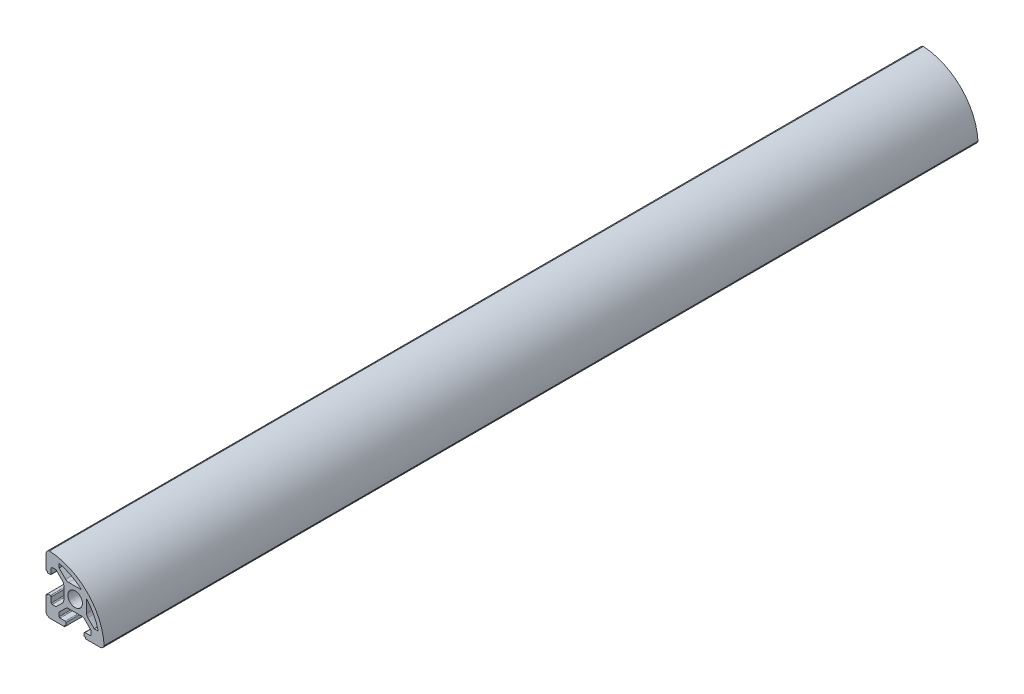
from build123d import *

# Parameters (mm, degrees)
SKETCH_1_R      = 2.5
EXTRUDE_1_DEPTH = 300


with BuildPart() as part:
    # 草图1 → 凸台-拉伸1 (new body)
    with BuildSketch(Plane.XY):
        with BuildLine():
            ThreePointArc((-8.944458369, 9.930115847), (-9.792033903, 9.405190523), (-10.123344197, 8.464890373))
            Line((-10.123344197, 8.464890373), (-10.123344197, 3.564890373))
            Line((-10.123344197, 3.564890373), (-9.823344197, 3.564890373))
            ThreePointArc((-9.823344197, 3.564890373), (-9.681922841, 3.50631173), (-9.623344197, 3.364890373))
            Line((-9.623344197, 3.364890373), (-9.623344197, 3.064890373))
            Line((-9.623344197, 3.064890373), (-8.623344197, 3.064890373))
            ThreePointArc((-8.623344197, 3.064890373), (-8.411212162, 3.152758339), (-8.323344197, 3.364890373))
            Line((-8.323344197, 3.364890373), (-8.323344197, 5.164890373))
            ThreePointArc((-8.323344197, 5.164890373), (-8.235476231, 5.377022408), (-8.023344197, 5.464890373))
            Line((-8.023344197, 5.464890373), (-6.683344197, 5.464890373))
            Line((-6.683344197, 5.464890373), (-4.462684025, 3.244230202))
            ThreePointArc((-4.462684025, 3.244230202), (-4.137524898, 2.757595178), (-4.023344197, 2.18357003))
            Line((-4.023344197, 2.18357003), (-4.023344197, -2.253789283))
            ThreePointArc((-4.023344197, -2.253789283), (-4.137524898, -2.827814432), (-4.462684025, -3.314449455))
            Line((-4.462684025, -3.314449455), (-6.683344197, -5.535109627))
            Line((-6.683344197, -5.535109627), (-8.023344197, -5.535109627))
            ThreePointArc((-8.023344197, -5.535109627), (-8.235476231, -5.447241661), (-8.323344197, -5.235109627))
            Line((-8.323344197, -5.235109627), (-8.323344197, -3.435109627))
            ThreePointArc((-8.323344197, -3.435109627), (-8.411212162, -3.222977592), (-8.623344197, -3.135109627))
            Line((-8.623344197, -3.135109627), (-9.623344197, -3.135109627))
            Line((-9.623344197, -3.135109627), (-9.623344197, -3.435109627))
            ThreePointArc((-9.623344197, -3.435109627), (-9.681922841, -3.576530983), (-9.823344197, -3.635109627))
            Line((-9.823344197, -3.635109627), (-10.123344197, -3.635109627))
            Line((-10.123344197, -3.635109627), (-10.123344197, -8.535109627))
            ThreePointArc((-10.123344197, -8.535109627), (-9.684004369, -9.595769798), (-8.623344197, -10.035109627))
            Line((-8.623344197, -10.035109627), (-3.723344197, -10.035109627))
            Line((-3.723344197, -10.035109627), (-3.723344197, -9.735109627))
            ThreePointArc((-3.723344197, -9.735109627), (-3.664765553, -9.59368827), (-3.523344197, -9.535109627))
            Line((-3.523344197, -9.535109627), (-3.223344197, -9.535109627))
            Line((-3.223344197, -9.535109627), (-3.223344197, -8.535109627))
            ThreePointArc((-3.223344197, -8.535109627), (-3.311212162, -8.322977592), (-3.523344197, -8.235109627))
            Line((-3.523344197, -8.235109627), (-5.323344197, -8.235109627))
            ThreePointArc((-5.323344197, -8.235109627), (-5.535476231, -8.147241661), (-5.623344197, -7.935109627))
            Line((-5.623344197, -7.935109627), (-5.623344197, -6.595109627))
            Line((-5.623344197, -6.595109627), (-3.402684025, -4.374449455))
            ThreePointArc((-3.402684025, -4.374449455), (-2.916049002, -4.049290328), (-2.342023853, -3.935109627))
            Line((-2.342023853, -3.935109627), (2.09533546, -3.935109627))
            ThreePointArc((2.09533546, -3.935109627), (2.669360608, -4.049290328), (3.155995631, -4.374449455))
            Line((3.155995631, -4.374449455), (5.376655803, -6.595109627))
            Line((5.376655803, -6.595109627), (5.376655803, -7.935109627))
            ThreePointArc((5.376655803, -7.935109627), (5.288787838, -8.147241661), (5.076655803, -8.235109627))
            Line((5.076655803, -8.235109627), (3.276655803, -8.235109627))
            ThreePointArc((3.276655803, -8.235109627), (3.064523769, -8.322977592), (2.976655803, -8.535109627))
            Line((2.976655803, -8.535109627), (2.976655803, -9.535109627))
            Line((2.976655803, -9.535109627), (3.276655803, -9.535109627))
            ThreePointArc((3.276655803, -9.535109627), (3.418077159, -9.59368827), (3.476655803, -9.735109627))
            Line((3.476655803, -9.735109627), (3.476655803, -10.035109627))
            Line((3.476655803, -10.035109627), (8.376655803, -10.035109627))
            ThreePointArc((8.376655803, -10.035109627), (9.316955952, -9.703799333), (9.841881277, -8.856223799))
            ThreePointArc((9.841881277, -8.856223799), (4.018791427, 4.107025997), (-8.944458369, 9.930115847))
        make_face()
        with BuildLine():
            ThreePointArc((7.820216628, -5.531930203), (7.798494154, -5.534313715), (7.776655803, -5.535109627))
            Line((7.776655803, -5.535109627), (6.436655803, -5.535109627))
            Line((6.436655803, -5.535109627), (4.215995631, -3.314449455))
            ThreePointArc((4.215995631, -3.314449455), (3.890836504, -2.827814432), (3.776655803, -2.253789283))
            Line((3.776655803, -2.253789283), (3.776655803, 2.173084343))
            ThreePointArc((3.776655803, 2.173084343), (6.257892136, -1.4383023), (7.820216628, -5.531930203))
        make_face(mode=Mode.SUBTRACT)
        with BuildLine():
            ThreePointArc((-5.620164773, 7.908451198), (-1.52653687, 6.346126706), (2.084849773, 3.864890373))
            Line((2.084849773, 3.864890373), (-2.342023853, 3.864890373))
            ThreePointArc((-2.342023853, 3.864890373), (-2.916049002, 3.979071075), (-3.402684025, 4.304230202))
            Line((-3.402684025, 4.304230202), (-5.623344197, 6.524890373))
            Line((-5.623344197, 6.524890373), (-5.623344197, 7.864890373))
            ThreePointArc((-5.623344197, 7.864890373), (-5.622548285, 7.886728724), (-5.620164773, 7.908451198))
        make_face(mode=Mode.SUBTRACT)
        with Locations((-0.123344197, -0.035109627)):
            Circle(SKETCH_1_R, mode=Mode.SUBTRACT)
    extrude(amount=EXTRUDE_1_DEPTH)


solid = part.part
